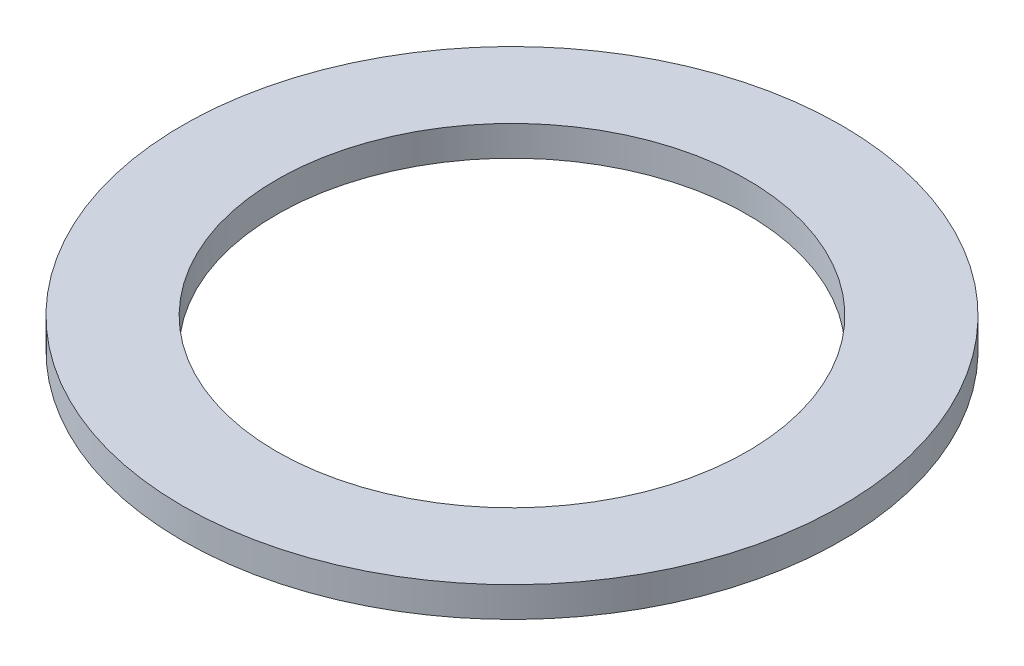
from build123d import *

# Parameters (mm, degrees)
SKETCH1_R           = 5.55625
BOSS_EXTRUDE1_DEPTH = 0.508
SKETCH5_R           = 3.96875
CUT_EXTRUDE1_DEPTH  = 8.874128023


with BuildPart() as part:
    # Sketch1 → Boss-Extrude1 (new body)
    with BuildSketch(Plane(origin=(0, 0, 0), x_dir=(1, 0, 0), z_dir=(0, 1, 0))):
        with Locations(Location((0, 0, 0), (0, 0, 270))):
            Circle(SKETCH1_R)
    extrude(amount=BOSS_EXTRUDE1_DEPTH)

    # Sketch5 → Cut-Extrude1 (cut, through all)
    with BuildSketch(Plane(origin=(0, 0.508, 0), x_dir=(-1, 0, 0), z_dir=(0, 1, 0))):
        with Locations(Location((0, 0, 0), (0, 0, 90))):
            Circle(SKETCH5_R)
    extrude(amount=-CUT_EXTRUDE1_DEPTH, mode=Mode.SUBTRACT)


solid = part.part
